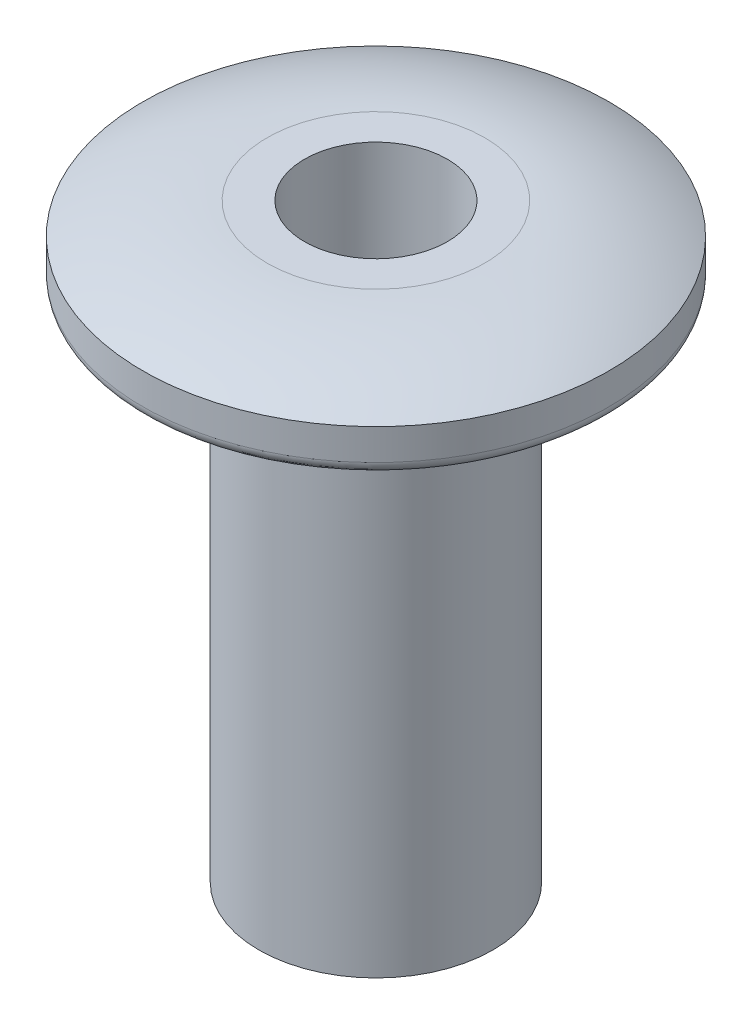
from build123d import *


with BuildPart() as part:
    # Sketch1 → Revolve1 (revolve)
    with BuildSketch(Plane.XY, mode=Mode.PRIVATE) as revolve1_sk:
        with BuildLine():
            Line((-1.4605, 0), (-1.4605, 12.065))
            Line((-1.4605, 12.065), (-2.2225, 12.065))
            ThreePointArc((-2.2225, 12.065), (-3.531586036, 11.903844145), (-4.7625, 11.43))
            Line((-4.7625, 11.43), (-4.7625, 10.795))
            ThreePointArc((-4.7625, 10.795), (-4.688105122, 10.615394878), (-4.5085, 10.541))
            Line((-4.5085, 10.541), (-2.39395, 10.541))
            Line((-2.39395, 10.541), (-2.39395, 0))
            Line((-2.39395, 0), (-1.4605, 0))
        make_face()
    revolve(revolve1_sk.sketch.rotate(Axis((0, 0, 0), (0, 1, 0)), 270), axis=Axis((0, 0, 0), (0, 1, 0)))


solid = part.part
